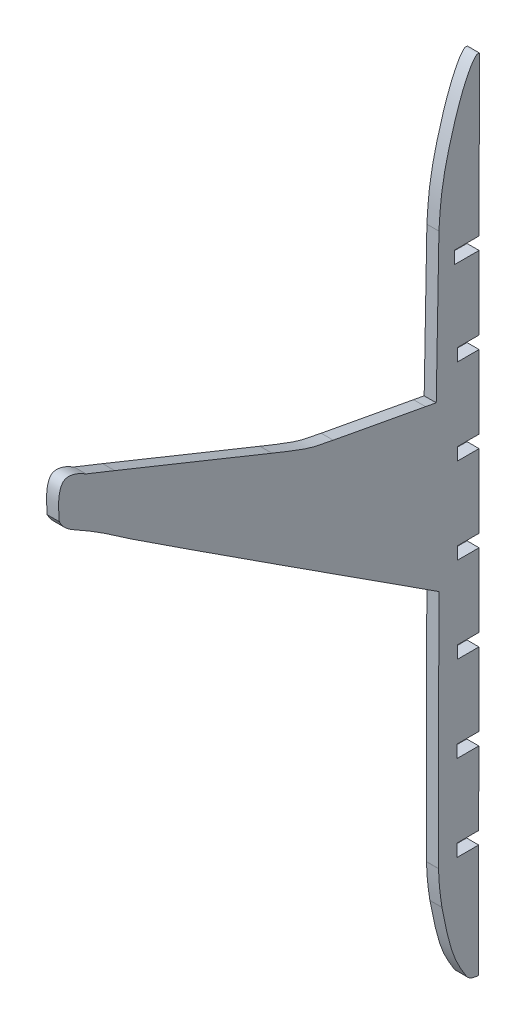
from build123d import *

# Parameters (mm, degrees)
SALIENTE_EXTRUIR1_DEPTH = 2.7


with BuildPart() as part:
    # Croquis1 → Saliente-Extruir1 (new body)
    with BuildSketch(Plane.YZ):
        with BuildLine():
            Line((50.064155465, -47.067534137), (50.064155465, -41.548360968))
            Line((50.064155465, -41.548360968), (47.264155465, -41.548360968))
            Line((47.264155465, -41.548360968), (47.264155465, -47.062731671))
            Line((47.264155465, -47.062731671), (30.853386223, -47.061763035))
            Line((30.853386223, -47.061763035), (30.853386223, -42.21693048))
            Line((30.853386223, -42.21693048), (28.053386223, -42.21693048))
            Line((28.053386223, -42.21693048), (28.053386223, -47.059093276))
            Line((28.053386223, -47.059093276), (11.642735672, -47.059093276))
            Line((11.642735672, -47.059093276), (11.642735672, -42.214260722))
            Line((11.642735672, -42.214260722), (8.842735672, -42.214260722))
            Line((8.842735672, -42.214260722), (8.842735672, -47.059093276))
            Line((8.842735672, -47.059093276), (-7.589284622, -47.059093276))
            Line((-7.589284622, -47.059093276), (-7.589284622, -42.224644755))
            Line((-7.589284622, -42.224644755), (-10.389284622, -42.224644755))
            Line((-10.389284622, -42.224644755), (-10.389284622, -47.065198628))
            Line((-10.389284622, -47.065198628), (-26.800014758, -47.040121306))
            Line((-26.800014758, -47.040121306), (-26.800014758, -42.191010057))
            Line((-26.800014758, -42.191010057), (-29.600014758, -42.191010057))
            Line((-29.600014758, -42.191010057), (-29.600014758, -47.035842611))
            Line((-29.600014758, -47.035842611), (-45.988557712, -47.010799194))
            Line((-45.988557712, -47.010799194), (-45.988557712, -42.161654196))
            Line((-45.988557712, -42.161654196), (-48.788557712, -42.161654196))
            Line((-48.788557712, -42.161654196), (-48.788557712, -47.0065205))
            Line((-48.788557712, -47.0065205), (-65.177781836, -46.981476041))
            Line((-65.177781836, -46.981476041), (-65.177781836, -42.131476041))
            Line((-65.177781836, -42.131476041), (-67.977781836, -42.131476041))
            Line((-67.977781836, -42.131476041), (-67.977781836, -46.977097597))
            Line((-67.977781836, -46.977097597), (-93.277781836, -46.977097597))
            add(Edge.make_bspline(
                [(-93.277781836, -46.977097597), (-93.18189011, -46.174781474), (-93.062415858, -45.1747221), (-92.318917636, -44.427844981), (-92.105764404, -44.271573649), (-92.0449928, -44.227097597)],
                knots=[0, 0, 0, 0, 0.743763164, 0.927075916, 1, 1, 1, 1], degree=3))
            add(Edge.make_bspline(
                [(-92.0449928, -44.227097597), (-90.756880888, -43.433276038), (-88.056893467, -41.769361434), (-82.577993979, -40.034501162), (-78.460600187, -39.237788639), (-75.964948435, -38.754904184)],
                knots=[0, 0, 0, 0, 0.264367579, 0.554135964, 1, 1, 1, 1], degree=3))
            add(Edge.make_bspline(
                [(-75.964948435, -38.754904184), (-74.34547887, -38.512314185), (-71.726644132, -38.12002332), (-69.081865258, -38.016574407), (-68.072599626, -37.977097597)],
                knots=[0, 0, 0, 0, 0.618393189, 1, 1, 1, 1], degree=3))
            Line((-68.072599626, -37.977097597), (-68.036182291, -37.977097597))
            Line((-68.036182291, -37.977097597), (-14.377781836, -38.059093276))
            add(Edge.make_bspline(
                [(-14.377781836, -38.059093276), (-9.48263554, -30.465223104), (-0.088318644, -15.891667241), (11.40131096, 1.897290918), (19.839368531, 14.904950582), (25.291082064, 23.281540451), (28.673986537, 28.425441102), (30.209064616, 30.759604208)],
                knots=[0, 0, 0, 0, 0.33054333, 0.634352652, 0.774759444, 0.897791923, 1, 1, 1, 1], degree=3))
            add(Edge.make_bspline(
                [(30.209064616, 30.759604208), (32.825669768, 34.503403378), (36.379896904, 39.588737934), (39.581896311, 45.827909193), (41.360854644, 46.769635372), (41.659064616, 46.927495864)],
                knots=[0, 0, 0, 0, 0.699056578, 0.949553224, 1, 1, 1, 1], degree=3))
            add(Edge.make_bspline(
                [(41.659064616, 46.927495864), (42.801110062, 47.007732625), (44.717786332, 47.142392673), (47.211435726, 46.979305401), (49.611125337, 46.046610037), (49.252809931, 43.170115935), (48.39102063, 41.703725793), (47.911284937, 40.887423293)],
                knots=[0, 0, 0, 0, 0.262398196, 0.440378618, 0.595477593, 0.774812574, 1, 1, 1, 1], degree=3))
            add(Edge.make_bspline(
                [(47.911284937, 40.887423293), (47.862540118, 40.735589847), (47.793730232, 40.52125646), (47.512079427, 39.861446577), (46.711064578, 37.894379756), (45.948121655, 35.982323112), (45.367624024, 34.527495864)],
                knots=[0, 0, 0, 0, 0.069771666, 0.098492117, 0.314069352, 1, 1, 1, 1], degree=3))
            add(Edge.make_bspline(
                [(45.367624024, 34.527495864), (44.111486236, 31.433076876), (41.38368553, 24.713305857), (37.555483502, 15.243358948), (34.065854034, 6.600610588), (32.047891551, 1.58322579), (31.135238415, -0.685978386)],
                knots=[0, 0, 0, 0, 0.263789487, 0.572839347, 0.80680877, 1, 1, 1, 1], degree=3))
            add(Edge.make_bspline(
                [(31.135238415, -0.685978386), (30.608083206, -1.997168161), (29.719537274, -4.207242768), (28.603409167, -7.0900084), (27.825404021, -9.400037124), (27.274005048, -11.767009415), (26.97035134, -13.458127119), (26.800509876, -14.404083303)],
                knots=[0, 0, 0, 0, 0.293827362, 0.495260414, 0.64274926, 0.800165568, 1, 1, 1, 1], degree=3))
            add(Edge.make_bspline(
                [(26.800509876, -14.404083303), (26.471785049, -16.186318296), (25.749496747, -20.102321536), (24.719420371, -25.646090651), (23.769164139, -30.756143455), (23.214984213, -33.732893289), (22.9640056, -35.081028837)],
                knots=[0, 0, 0, 0, 0.258531991, 0.568057591, 0.804378282, 1, 1, 1, 1], degree=3))
            add(Edge.make_bspline(
                [(22.9640056, -35.081028837), (22.868341833, -35.597842053), (22.720682865, -36.395553759), (22.566553172, -37.192037906), (22.512279431, -37.472504136)],
                knots=[0, 0, 0, 0, 0.647869665, 1, 1, 1, 1], degree=3))
            Line((22.512279431, -37.472504136), (55.496451659, -38.078985867))
            add(Edge.make_bspline(
                [(55.496451659, -38.078985867), (57.927924447, -38.23069105), (63.002233618, -38.547288944), (70.411961322, -40.227716027), (77.16001838, -42.232666736), (82.119612572, -44.187612736), (84.628190587, -45.650882843), (85.592784128, -46.565402982), (85.535281658, -46.977532137), (85.512279431, -47.142392673)],
                knots=[0, 0, 0, 0, 0.227073389, 0.473885964, 0.705746601, 0.886968223, 0.962928971, 0.98517079, 1, 1, 1, 1], degree=3))
            Line((85.512279431, -47.142392673), (50.064155465, -47.067534137))
        make_face()
    extrude(amount=SALIENTE_EXTRUIR1_DEPTH)


solid = part.part
